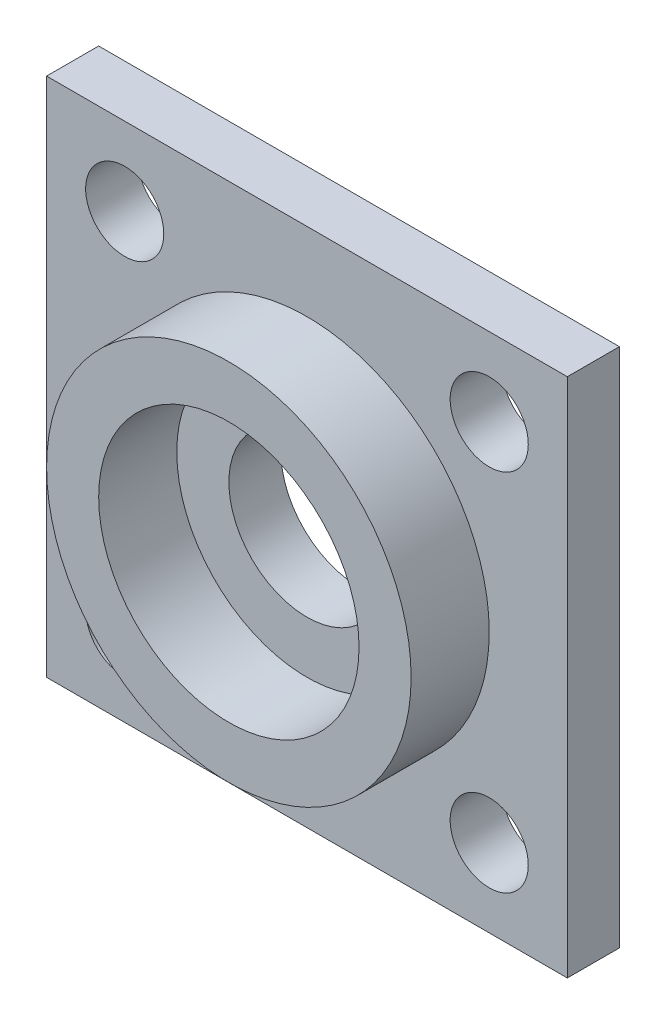
from build123d import *

# Parameters (mm, degrees)
SKETCH_1_W      = 20
SKETCH_1_H      = 20
SKETCH_1_R      = 1.5
SKETCH_1_R_2    = 3
EXTRUDE_1_DEPTH = 2
SKETCH_2_R      = 7
SKETCH_2_R_2    = 5
EXTRUDE_2_DEPTH = 3


with BuildPart() as part:
    # 草图1 → 凸台-拉伸1 (new body)
    with BuildSketch(Plane.XY):
        Rectangle(SKETCH_1_W, SKETCH_1_H)
        with Locations((-7, 7)):
            Circle(SKETCH_1_R, mode=Mode.SUBTRACT)
        with Locations((7, 7)):
            Circle(SKETCH_1_R, mode=Mode.SUBTRACT)
        with Locations((7, -7)):
            Circle(SKETCH_1_R, mode=Mode.SUBTRACT)
        with Locations((-7, -7)):
            Circle(SKETCH_1_R, mode=Mode.SUBTRACT)
        Circle(SKETCH_1_R_2, mode=Mode.SUBTRACT)
    extrude(amount=EXTRUDE_1_DEPTH)

    # 草图2 → 凸台-拉伸2 (add)
    with BuildSketch(Plane.XY.offset(2)):
        Circle(SKETCH_2_R)
        Circle(SKETCH_2_R_2, mode=Mode.SUBTRACT)
    extrude(amount=EXTRUDE_2_DEPTH)


solid = part.part
